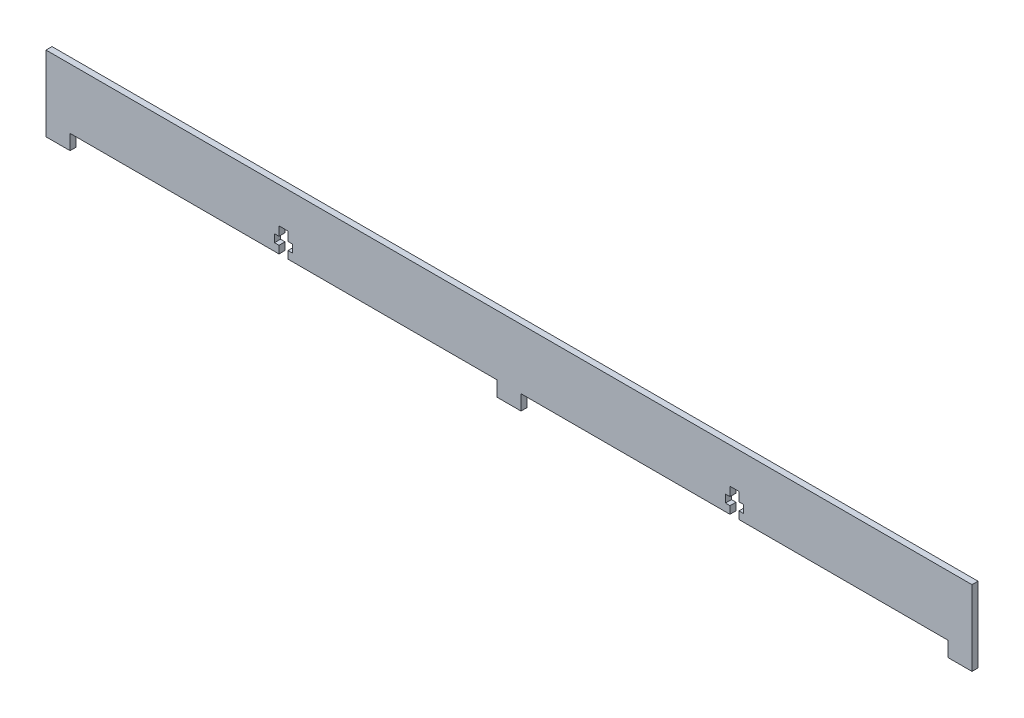
from build123d import *

# Parameters (mm, degrees)
EXTRUDE_1_DEPTH = 2


with BuildPart() as part:
    # 草图1 → 凸台-拉伸1 (new body)
    with BuildSketch(Plane.XY):
        Polygon((-229, 0), (-229, -5), (-221, -5), (-221, 0), (-151.5, 0), (-151.5, 2.5), (-153, 2.5), (-153, 5.1), (-151.5, 5.1), (-151.5, 8.1), (-148.5, 8.1), (-148.5, 5.1), (-147, 5.1), (-147, 2.5), (-148.5, 2.5), (-148.5, 0), (-79, 0), (-79, -5), (-71, -5), (-71, 0), (-1.5, 0), (-1.5, 2.5), (-3, 2.5), (-3, 5.1), (-1.5, 5.1), (-1.5, 8.1), (1.5, 8.1), (1.5, 5.1), (3, 5.1), (3, 2.5), (1.5, 2.5), (1.5, 0), (71, 0), (71, -5), (79, -5), (79, 0), (79, 20), (71, 20), (-229, 20), align=None)
    extrude(amount=EXTRUDE_1_DEPTH)


solid = part.part
